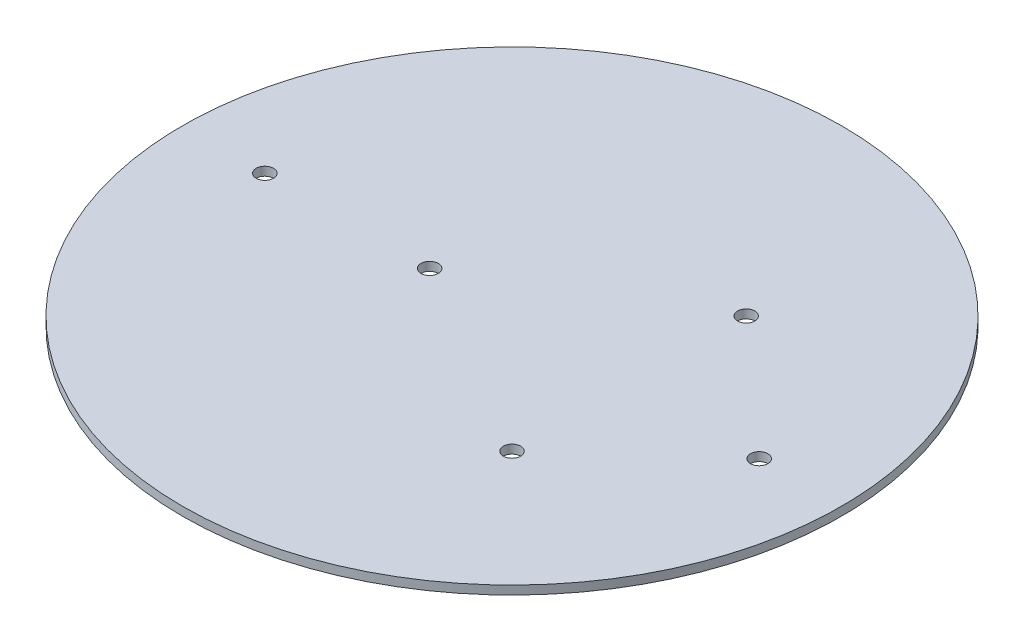
from build123d import *

# Parameters (mm, degrees)
SKETCH1_R           = 38
SKETCH1_R_2         = 1
BOSS_EXTRUDE1_DEPTH = 1


with BuildPart() as part:
    # Sketch1 → Boss-Extrude1 (new body)
    with BuildSketch(Plane(origin=(0, 0, 0), x_dir=(1, 0, 0), z_dir=(0, 1, 0))):
        with Locations(Location((0, 0, 0), (0, 0, 270))):
            Circle(SKETCH1_R)
        with Locations(Location((28.5, 0, 0), (0, 0, 270))):
            Circle(SKETCH1_R_2, mode=Mode.SUBTRACT)
        with Locations(Location((-28.5, 0, 0), (0, 0, 270))):
            Circle(SKETCH1_R_2, mode=Mode.SUBTRACT)
        with Locations(Location((13.5, 13.5, 0), (0, 0, 270))):
            Circle(SKETCH1_R_2, mode=Mode.SUBTRACT)
        with Locations(Location((13.5, -13.5, 0), (0, 0, 270))):
            Circle(SKETCH1_R_2, mode=Mode.SUBTRACT)
        with Locations(Location((-9.5, 0, 0), (0, 0, 270))):
            Circle(SKETCH1_R_2, mode=Mode.SUBTRACT)
    extrude(amount=-BOSS_EXTRUDE1_DEPTH)


solid = part.part
